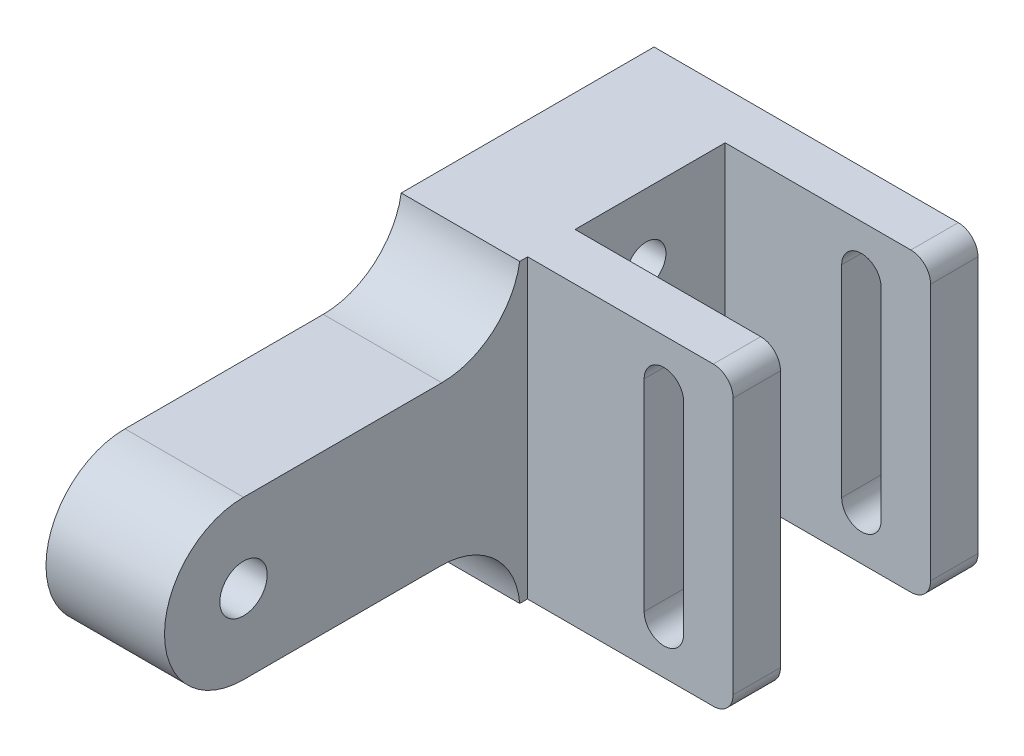
from build123d import *

# Parameters (mm, degrees)
SKETCH2_R           = 6
SKETCH2_R_2         = 5
BOSS_EXTRUDE3_DEPTH = 30
BOSS_EXTRUDE6_DEPTH = 12
LPATTERN1_COUNT     = 2
LPATTERN1_PITCH     = 50


with BuildPart() as part:
    # Sketch2 → Boss-Extrude3 (new body)
    with BuildSketch(Plane(origin=(0, 0, 0), x_dir=(0, 0, -1), z_dir=(1, 0, 0))):
        with BuildLine():
            Line((-101.923792087, 20.755721108), (-51.733227817, 20.755721108))
            ThreePointArc((-51.733227817, 20.755721108), (-38.793259157, 25.505894516), (-32, 37.5))
            Line((-32, 37.5), (32, 37.5))
            Line((32, 37.5), (32, -37.5))
            Line((32, -37.5), (-32, -37.5))
            ThreePointArc((-32, -37.5), (-38.41241869, -24.498337453), (-51.923792087, -19.244278892))
            Line((-51.923792087, -19.244278892), (-101.923792087, -19.244278892))
            ThreePointArc((-101.923792087, -19.244278892), (-121.923792087, 0.755721108), (-101.923792087, 20.755721108))
        make_face()
        with Locations((-101.923792087, 0.755721108)):
            Circle(SKETCH2_R, mode=Mode.SUBTRACT)
        with Locations((0, 20.755721108)):
            Circle(SKETCH2_R_2, mode=Mode.SUBTRACT)
        with Locations((0, -16.696355723)):
            Circle(SKETCH2_R_2, mode=Mode.SUBTRACT)
    extrude(amount=BOSS_EXTRUDE3_DEPTH)

    # Sketch4 → Boss-Extrude6 (add)
    with BuildSketch(Plane(origin=(0, 0, -32), x_dir=(-1, 0, 0), z_dir=(0, 0, -1))):
        with BuildLine():
            Line((-30, 37.5), (-77, 37.5))
            ThreePointArc((-77, 37.5), (-80.535533906, 36.035533906), (-82, 32.5))
            Line((-82, 32.5), (-82, -32.543310804))
            ThreePointArc((-82, -32.543310804), (-80.535533906, -36.07884471), (-77, -37.543310804))
            Line((-77, -37.543310804), (-30, -37.543310804))
            Line((-30, -37.543310804), (-30, 37.5))
        make_face()
        with BuildLine():
            Line((-59.490773049, 25.5), (-59.490773049, -25.543310804))
            ThreePointArc((-59.490773049, -25.543310804), (-64.490773049, -30.543310804), (-69.490773049, -25.543310804))
            Line((-69.490773049, -25.543310804), (-69.490773049, 25.5))
            ThreePointArc((-69.490773049, 25.5), (-64.490773049, 30.5), (-59.490773049, 25.5))
        make_face(mode=Mode.SUBTRACT)
    boss_extrude6 = extrude(amount=-BOSS_EXTRUDE6_DEPTH)

    # LPattern1: Boss-Extrude6 ×2
    with Locations(*[(0, 0, i * LPATTERN1_PITCH) for i in range(1, LPATTERN1_COUNT)]):
        add(boss_extrude6)


solid = part.part
